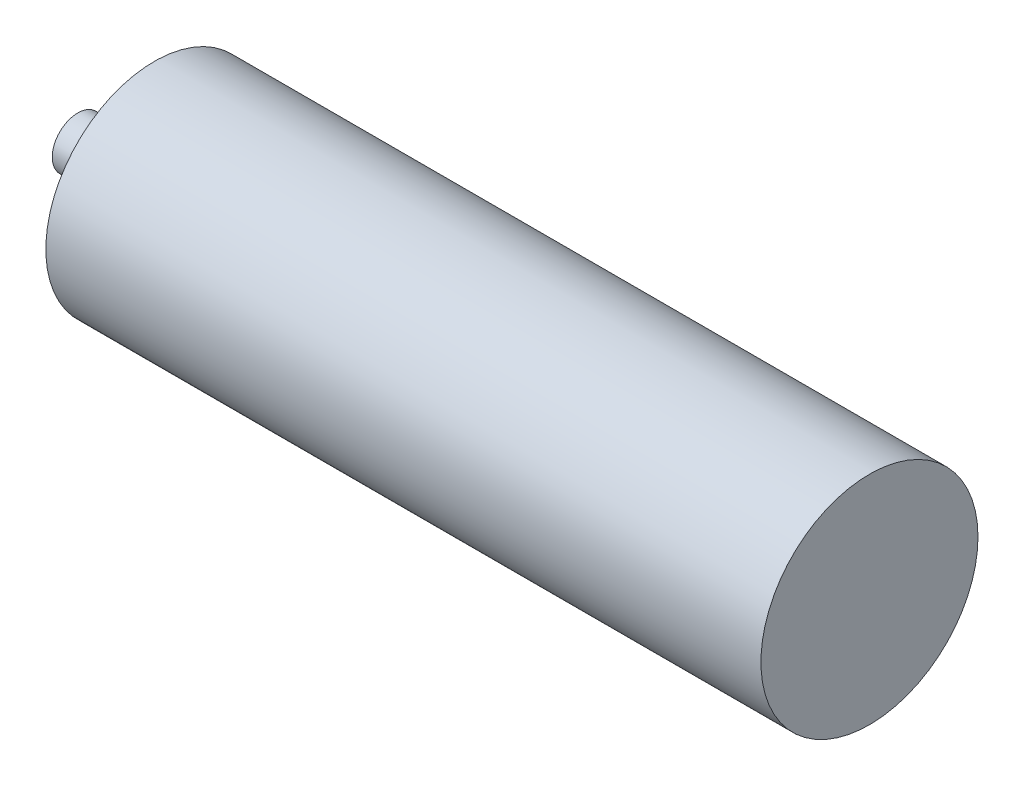
from build123d import *

# Parameters (mm, degrees)
SKETCH1_R           = 26.9875
BOSS_EXTRUDE1_DEPTH = 177.8
SKETCH4_R           = 6.35
BOSS_EXTRUDE3_DEPTH = 19.05


with BuildPart() as part:
    # Sketch1 → Boss-Extrude1 (new body)
    with BuildSketch(Plane.YZ):
        with Locations(Location((-10.271274645, 8.874381293, 0), (0, 0, 270))):
            Circle(SKETCH1_R)
    extrude(amount=BOSS_EXTRUDE1_DEPTH)

    # Sketch4 → Boss-Extrude3 (add)
    with BuildSketch(Plane.ZY):
        with Locations(Location((8.874381293, -10.271274645, 0), (0, 0, 180))):
            Circle(SKETCH4_R)
    extrude(amount=BOSS_EXTRUDE3_DEPTH)


solid = part.part
